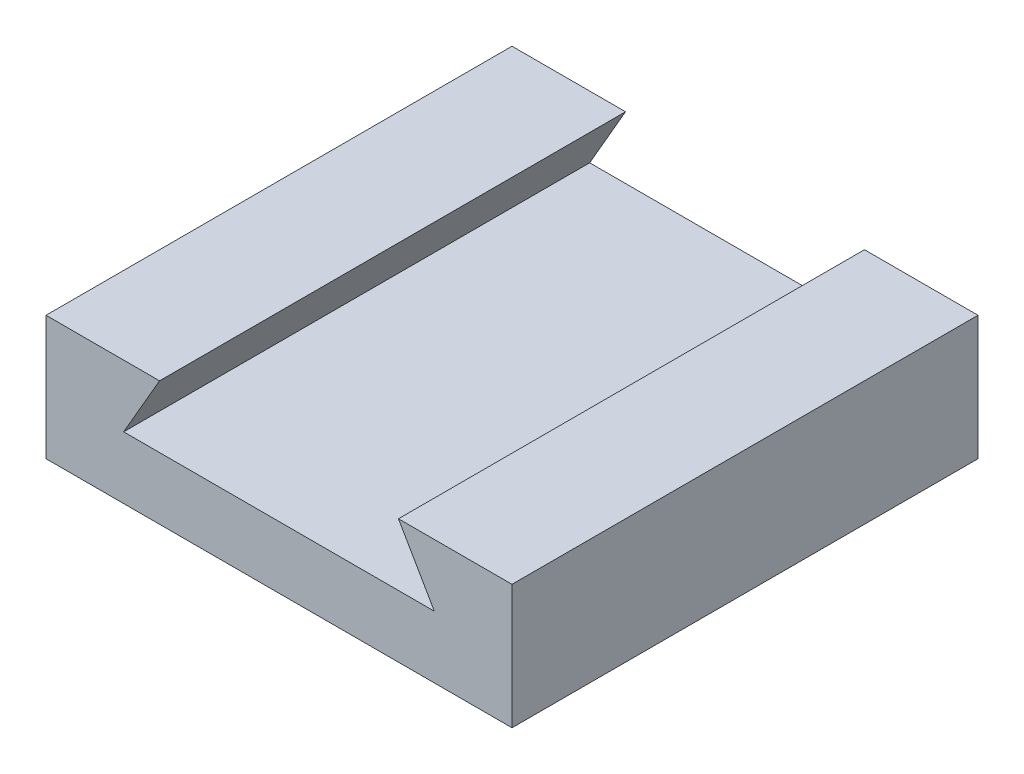
from build123d import *

# Parameters (mm, degrees)
SKETCH_1_W          = 30
SKETCH_1_H          = 8
EXTRUDE_1_DEPTH     = 30
CUT_EXTRUDE_1_DEPTH = 44.17406629


with BuildPart() as part:
    # Эскиз1 → Бобышка-Вытянуть1 (new body)
    with BuildSketch(Plane.XY):
        with Locations((15, 4)):
            Rectangle(SKETCH_1_W, SKETCH_1_H)
    extrude(amount=EXTRUDE_1_DEPTH)

    # Эскиз2 → Вырез-Вытянуть1 (cut, through all)
    with BuildSketch(Plane.XY.offset(30)):
        Polygon((7.309401077, 8), (5, 4), (25, 4), (22.690598923, 8), align=None)
    extrude(amount=-CUT_EXTRUDE_1_DEPTH, mode=Mode.SUBTRACT)


solid = part.part
